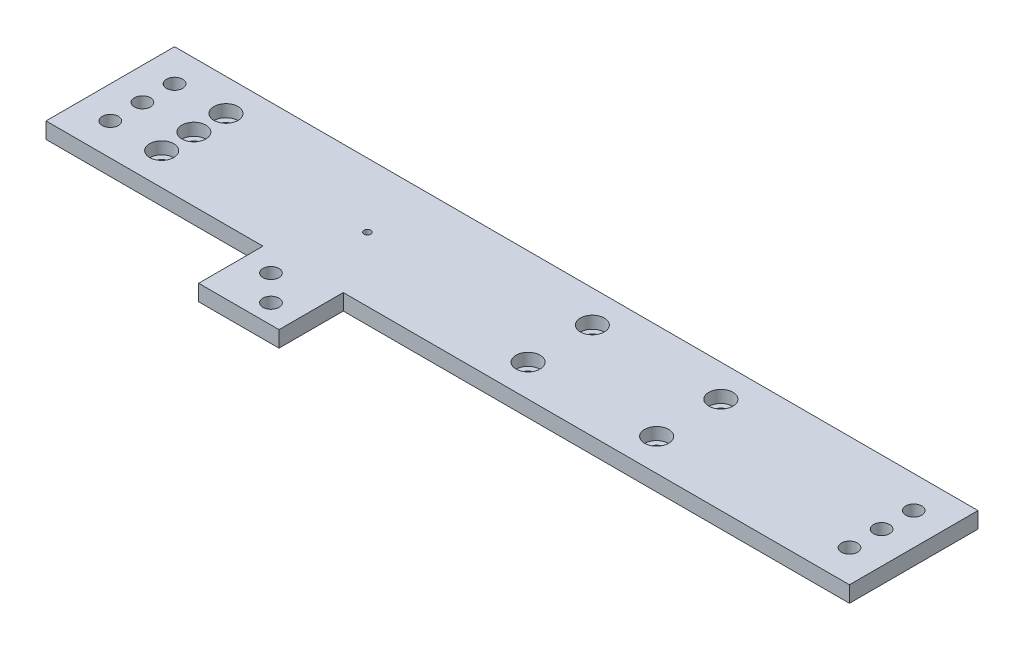
from build123d import *

# Parameters (mm, degrees)
SKETCH1_W                                       = 317.5
SKETCH1_H                                       = 50.8
BOSS_EXTRUDE1_DEPTH                             = 6.35
CBORE_FOR_10_SOCKET_HEAD_CAP_SCREW1_D           = 5.1054
CBORE_FOR_10_SOCKET_HEAD_CAP_SCREW1_CBORE_D     = 9.525
CBORE_FOR_10_SOCKET_HEAD_CAP_SCREW1_CBORE_DEPTH = 4.826
F_1_4_0_25_DIAMETER_HOLE1_D                     = 6.35
F_6_32_TAPPED_HOLE1_D                           = 2.7051
SKETCH12_W                                      = 31.75
SKETCH12_H                                      = 25.4
BOSS_EXTRUDE3_DEPTH                             = 6.35
F_1_4_0_25_DIAMETER_HOLE2_D                     = 6.35


with BuildPart() as part:
    # Sketch1 → Boss-Extrude1 (new body)
    with BuildSketch(Plane(origin=(0, 0, 0), x_dir=(1, 0, 0), z_dir=(0, 1, 0))):
        Rectangle(SKETCH1_W, SKETCH1_H)
    extrude(amount=BOSS_EXTRUDE1_DEPTH)

    # CBORE for #10 Socket Head Cap Screw1 (through all)
    with Locations(Plane(origin=(0, 6.35, 0), x_dir=(1, 0, 0), z_dir=(0, 1, 0))):
        with Locations((-125.73, -12.7), (19.05, 12.7), (69.85, 12.7), (19.05, -12.7), (69.85, -12.7), (-125.73, 12.7), (-125.73, 0)):
            CounterBoreHole(CBORE_FOR_10_SOCKET_HEAD_CAP_SCREW1_D / 2, CBORE_FOR_10_SOCKET_HEAD_CAP_SCREW1_CBORE_D / 2, CBORE_FOR_10_SOCKET_HEAD_CAP_SCREW1_CBORE_DEPTH)

    # 1/4 (0.25) Diameter Hole1 (through all)
    with Locations(Plane.XZ):
        with Locations((-146.05, 12.7), (-146.05, 0), (-146.05, -12.7), (146.05, 12.7), (146.05, 0), (146.05, -12.7)):
            Hole(F_1_4_0_25_DIAMETER_HOLE1_D / 2)

    # #6-32 Tapped Hole1 (through all)
    with Locations(Plane(origin=(0, 0, 0), x_dir=(-1, 0, 0), z_dir=(0, -1, 0))):
        with Locations((57.15, 0)):
            Hole(F_6_32_TAPPED_HOLE1_D / 2)

    # Sketch12 → Boss-Extrude3 (add)
    with BuildSketch(Plane(origin=(0, 6.35, 0), x_dir=(1, 0, 0), z_dir=(0, 1, 0))):
        with Locations((-57.15, -38.1)):
            Rectangle(SKETCH12_W, SKETCH12_H)
    extrude(amount=-BOSS_EXTRUDE3_DEPTH)

    # 1/4 (0.25) Diameter Hole2 (through all)
    with Locations(Plane(origin=(0, 0, 0), x_dir=(-1, 0, 0), z_dir=(0, -1, 0))):
        with Locations((52.07, -43.18), (62.23, -33.02)):
            Hole(F_1_4_0_25_DIAMETER_HOLE2_D / 2)


solid = part.part
